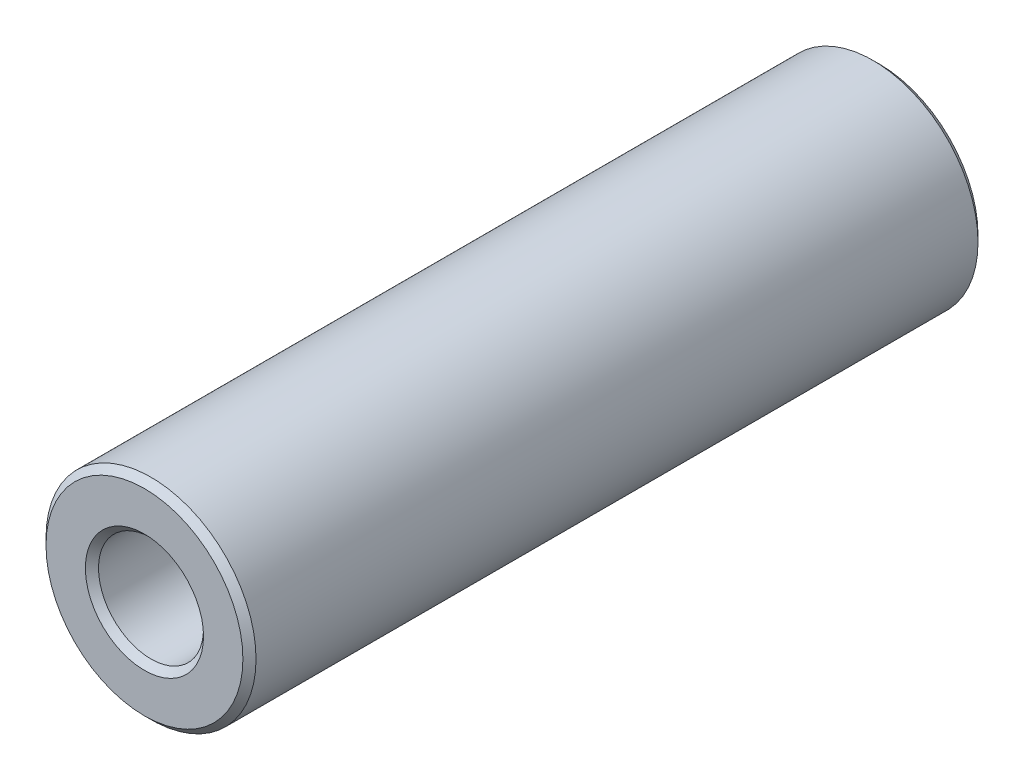
from build123d import *

# Parameters (mm, degrees)
ESQUISSE1_R          = 4
ESQUISSE1_R_2        = 2
BASE_EXTRUSION_DEPTH = 28
CHANFREIN1_SIZE      = 0.25


with BuildPart() as part:
    # Esquisse1 → Base-Extrusion (new body)
    with BuildSketch(Plane.XY):
        with Locations(Location((0, 0, 0), (0, 0, 180))):
            Circle(ESQUISSE1_R)
        with Locations(Location((0, 0, 0), (0, 0, 180))):
            Circle(ESQUISSE1_R_2, mode=Mode.SUBTRACT)
    extrude(amount=BASE_EXTRUSION_DEPTH)

    # Chanfrein1
    chanfrein1_edges = [part.edges().sort_by_distance(p)[0] for p in [
        (4, 0, 0),
        (4, 0, 28),
        (2, 0, 0),
        (2, 0, 28),
    ]]
    chamfer(chanfrein1_edges, length=CHANFREIN1_SIZE)


solid = part.part
